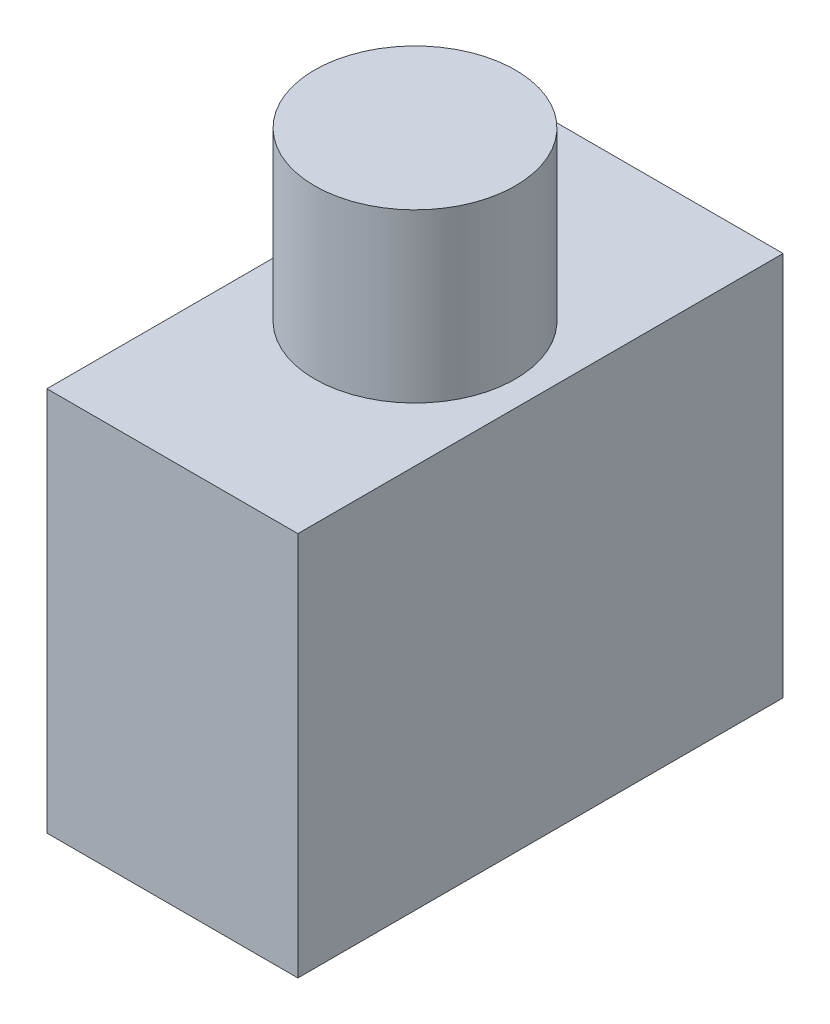
from build123d import *

# Parameters (mm, degrees)
SKETCH_1_W      = 15
SKETCH_1_H      = 29
EXTRUDE_1_DEPTH = 23
SKETCH_2_R      = 6
EXTRUDE_2_DEPTH = 10


with BuildPart() as part:
    # 草图1 → 凸台-拉伸1 (new body)
    with BuildSketch(Plane(origin=(0, 0, 0), x_dir=(1, 0, 0), z_dir=(0, 1, 0))):
        Rectangle(SKETCH_1_W, SKETCH_1_H)
    extrude(amount=EXTRUDE_1_DEPTH)

    # 草图2 → 凸台-拉伸2 (add)
    with BuildSketch(Plane(origin=(0, 23, 0), x_dir=(1, 0, 0), z_dir=(0, 1, 0))):
        with Locations(Location((0, 0, 0), (0, 0, 270))):
            Circle(SKETCH_2_R)
    extrude(amount=EXTRUDE_2_DEPTH)


solid = part.part
